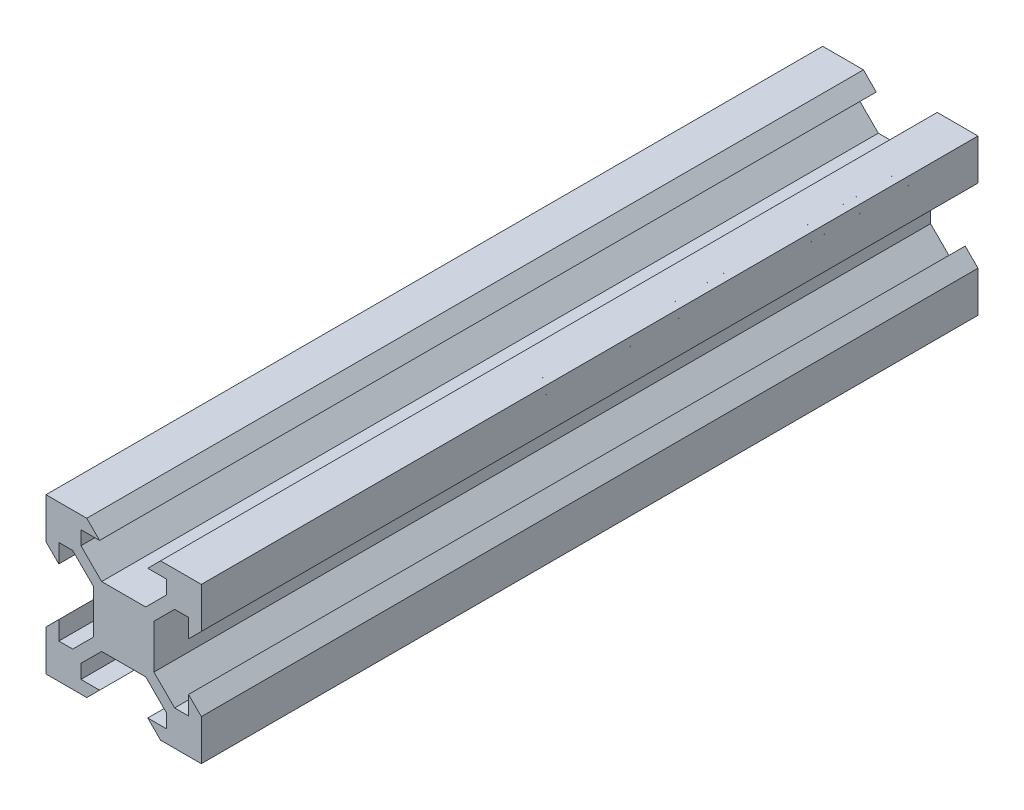
from build123d import *

# Parameters (mm, degrees)
BOSS_EXTRUDE1_DEPTH = 100


with BuildPart() as part:
    # Sketch1 → Boss-Extrude1 (new body)
    with BuildSketch(Plane.XY):
        Polygon((-2.834320347, 3.893970342), (2.834320347, 3.893970342), (5.5, 6.558849663), (5.5, 8.349069506), (3.1, 8.349069506), (4.75, 9.998574117), (10, 9.998574117), (10, 4.746997406), (8.35, 3.097492795), (8.350720674, 5.497492687), (6.560500912, 5.498030255), (3.894821259, 2.833150935), (3.894821259, -2.833150935), (6.560500912, -5.498030255), (8.350720674, -5.497492687), (8.35, -3.097492795), (10, -4.746997406), (10, -9.998574117), (4.75, -9.998574117), (3.1, -8.349069506), (5.5, -8.349069506), (5.5, -6.558849663), (2.834320347, -3.893970342), (-2.834320347, -3.893970342), (-5.5, -6.558849663), (-5.5, -8.349069506), (-3.1, -8.349069506), (-4.75, -9.998574117), (-10, -9.998574117), (-10, -4.746997406), (-8.35, -3.097492795), (-8.350720674, -5.497492687), (-6.560500912, -5.498030255), (-3.894821259, -2.833150935), (-3.894821259, 2.833150935), (-6.560500912, 5.498030255), (-8.350720674, 5.497492687), (-8.35, 3.097492795), (-10, 4.746997406), (-10, 9.998574117), (-4.75, 9.998574117), (-3.1, 8.349069506), (-5.5, 8.349069506), (-5.5, 6.558849663), align=None)
    extrude(amount=BOSS_EXTRUDE1_DEPTH)


solid = part.part
